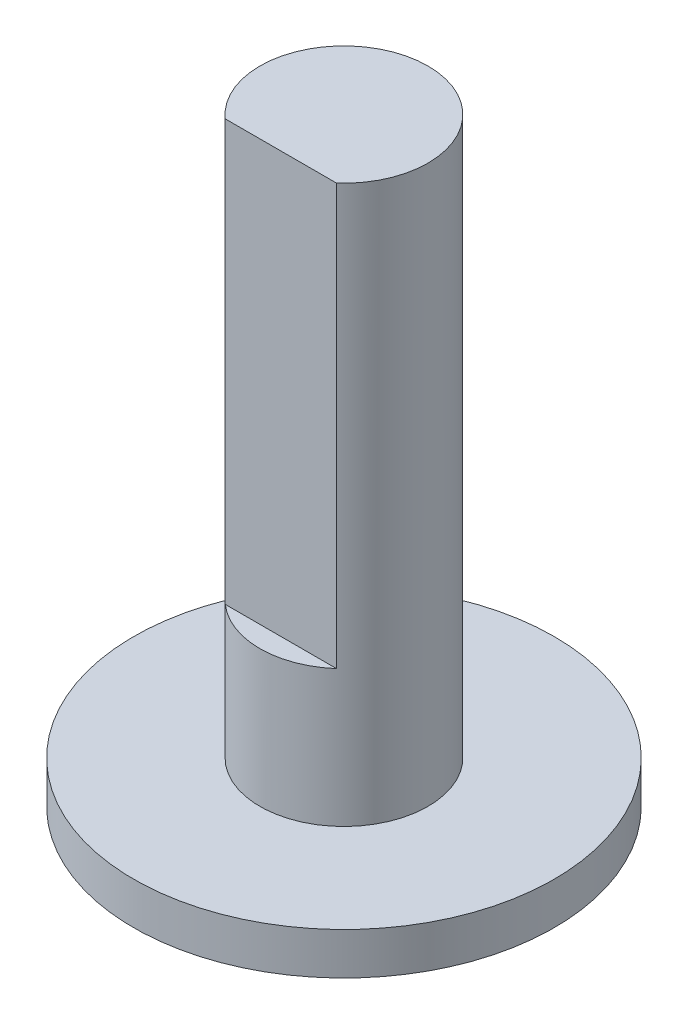
from build123d import *

# Parameters (mm, degrees)
CUT_EXTRUDE1_START = -20
CUT_EXTRUDE1_DEPTH = 20


with BuildPart() as part:
    # Sketch1 → Revolve1 (revolve)
    with BuildSketch(Plane.XY):
        Polygon((0, 22.5), (4, 22.5), (4, -4), (10, -4), (10, -6), (0, -6), align=None)
    revolve(axis=Axis((0, -6, 0), (0, 1, 0)))

    # Sketch2 → Cut-Extrude1 (cut)
    with BuildSketch(Plane(origin=(0, 22.5, 0), x_dir=(1, 0, 0), z_dir=(0, 1, 0)).offset(CUT_EXTRUDE1_START)):
        with BuildLine():
            Line((-2.645751311, -3), (2.645751311, -3))
            ThreePointArc((2.645751311, -3), (0, -4), (-2.645751311, -3))
        make_face()
    extrude(amount=CUT_EXTRUDE1_DEPTH, mode=Mode.SUBTRACT)


solid = part.part
